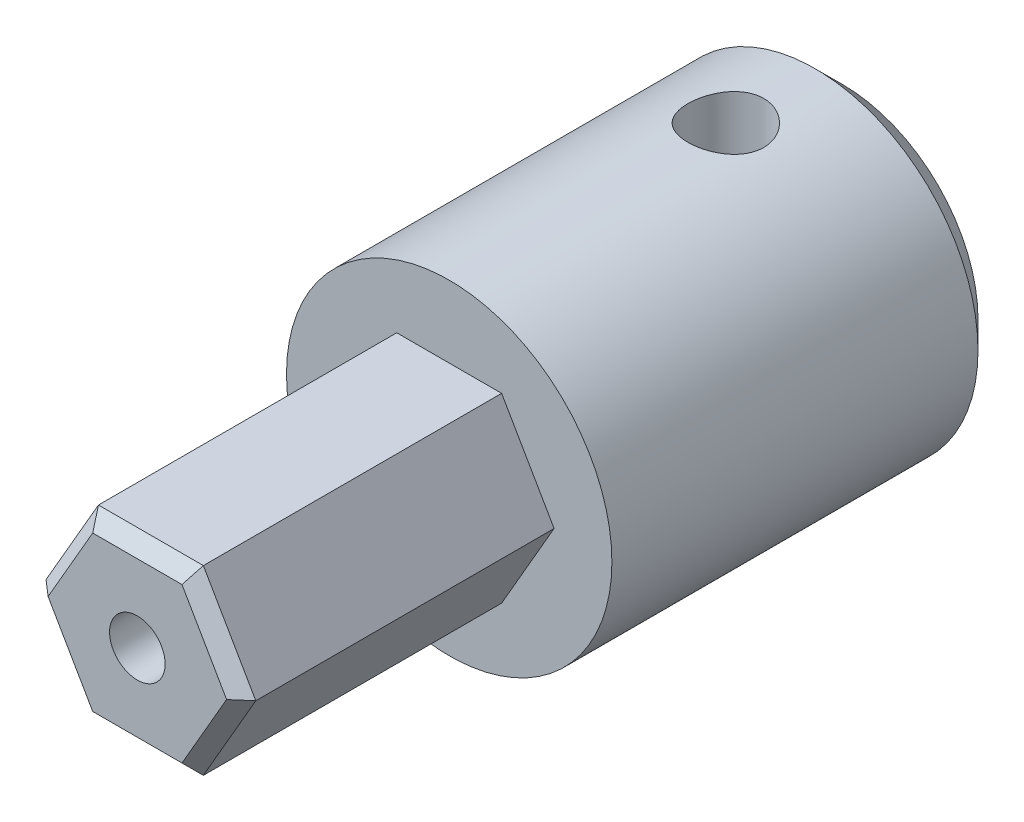
from build123d import *

# Parameters (mm, degrees)
SKETCH_1_R               = 6
EXTRUDE_1_DEPTH          = 14.5
EXTRUDE_2_DEPTH          = 11.5
HOLE_WIZARD_M2_5_1_D     = 2.05
HOLE_WIZARD_M2_5_1_DEPTH = 11
HOLE_WIZARD_M2_5_1_TIP   = 0.615882135
SKETCH_6_R               = 3
CUT_EXTRUDE_1_DEPTH      = 12
CHAMFER_2_SIZE           = 1
CHAMFER_3_SIZE           = 0.5
SKETCH_7_R               = 1.4
CUT_EXTRUDE_2_DEPTH      = 6


with BuildPart() as part:
    # 草图1 → 凸台-拉伸1 (new body)
    with BuildSketch(Plane.XY):
        with Locations(Location((0, 0, 0), (0, 0, 180))):
            Circle(SKETCH_1_R)
    extrude(amount=EXTRUDE_1_DEPTH)

    # 草图2 → 凸台-拉伸2 (add)
    with BuildSketch(Plane.XY.offset(14.5)):
        Polygon((3.868246804, 0), (1.934123402, 3.35), (-1.934123402, 3.35), (-3.868246804, 0), (-1.934123402, -3.35), (1.934123402, -3.35), align=None)
    extrude(amount=EXTRUDE_2_DEPTH)

    # M2.5 螺纹孔1
    with Locations(Plane.XY.offset(26)):
        with Locations((0, 0)):
            Hole(HOLE_WIZARD_M2_5_1_D / 2, depth=HOLE_WIZARD_M2_5_1_DEPTH)
            with Locations((0, 0, -(HOLE_WIZARD_M2_5_1_DEPTH + HOLE_WIZARD_M2_5_1_TIP / 2))):  # 118° drill point
                Cone(0, HOLE_WIZARD_M2_5_1_D / 2, HOLE_WIZARD_M2_5_1_TIP, mode=Mode.SUBTRACT)

    # 草图6 → 切除-拉伸1 (cut)
    with BuildSketch(Plane(origin=(0, 0, 0), x_dir=(-1, 0, 0), z_dir=(0, 0, -1))):
        Circle(SKETCH_6_R)
    extrude(amount=-CUT_EXTRUDE_1_DEPTH, mode=Mode.SUBTRACT)

    # 倒角2
    chamfer_2_edges = [part.edges().sort_by_distance(p)[0] for p in [
        (6, 0, 0),
    ]]
    chamfer(chamfer_2_edges, length=CHAMFER_2_SIZE)

    # 倒角3
    chamfer_3_edges = [part.edges().sort_by_distance(p)[0] for p in [
        (2.901185103, -1.675, 26),
        (2.901185103, 1.675, 26),
        (0, 3.35, 26),
        (-2.901185103, 1.675, 26),
        (-2.901185103, -1.675, 26),
        (0, -3.35, 26),
    ]]
    chamfer(chamfer_3_edges, length=CHAMFER_3_SIZE)

    # 草图7 → 切除-拉伸2 (cut)
    with BuildSketch(Plane(origin=(0, 6, 0), x_dir=(1, 0, 0), z_dir=(0, 1, 0))):
        with Locations(Location((0, -4.3, 0), (0, 0, 270))):
            Circle(SKETCH_7_R)
    extrude(amount=-CUT_EXTRUDE_2_DEPTH, mode=Mode.SUBTRACT)


solid = part.part
